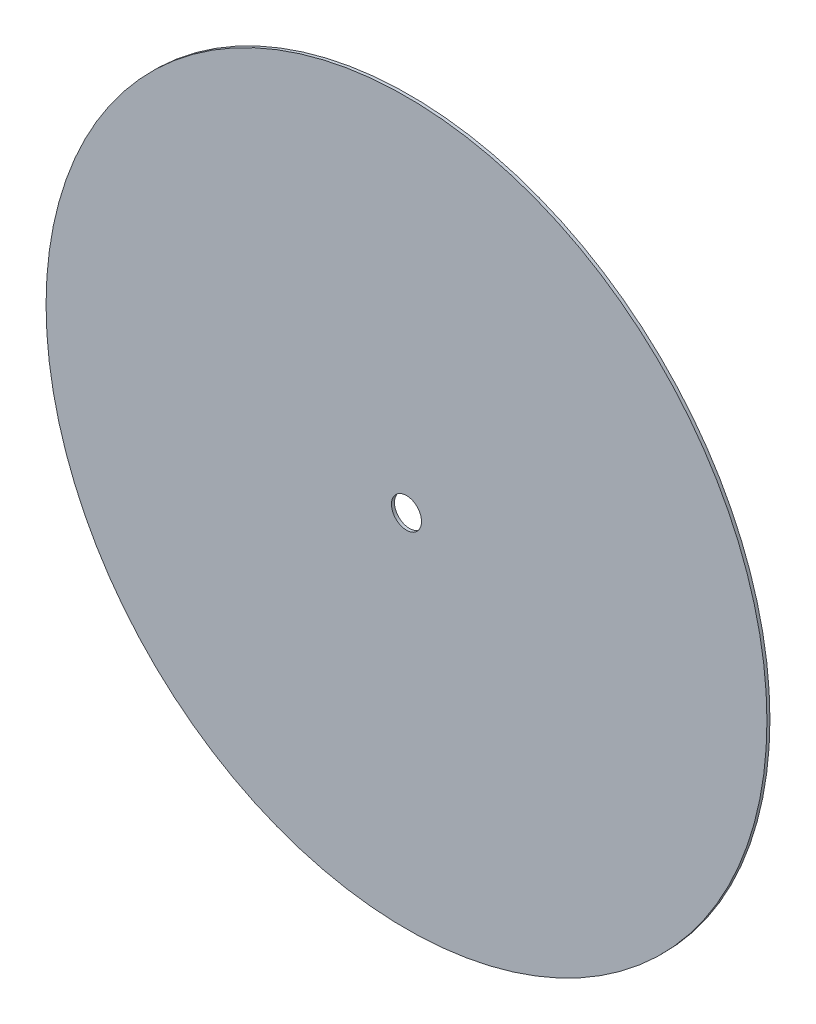
from build123d import *

# Parameters (mm, degrees)
SKETCH1_R           = 152.4
BOSS_EXTRUDE1_DEPTH = 1.27
SKETCH2_R           = 6.35
CUT_EXTRUDE1_DEPTH  = 216.529888647


with BuildPart() as part:
    # Sketch1 → Boss-Extrude1 (new body)
    with BuildSketch(Plane.XY):
        Circle(SKETCH1_R)
    extrude(amount=BOSS_EXTRUDE1_DEPTH)

    # Sketch2 → Cut-Extrude1 (cut, through all)
    with BuildSketch(Plane.XY.offset(1.27)):
        Circle(SKETCH2_R)
    extrude(amount=-CUT_EXTRUDE1_DEPTH, mode=Mode.SUBTRACT)


solid = part.part
